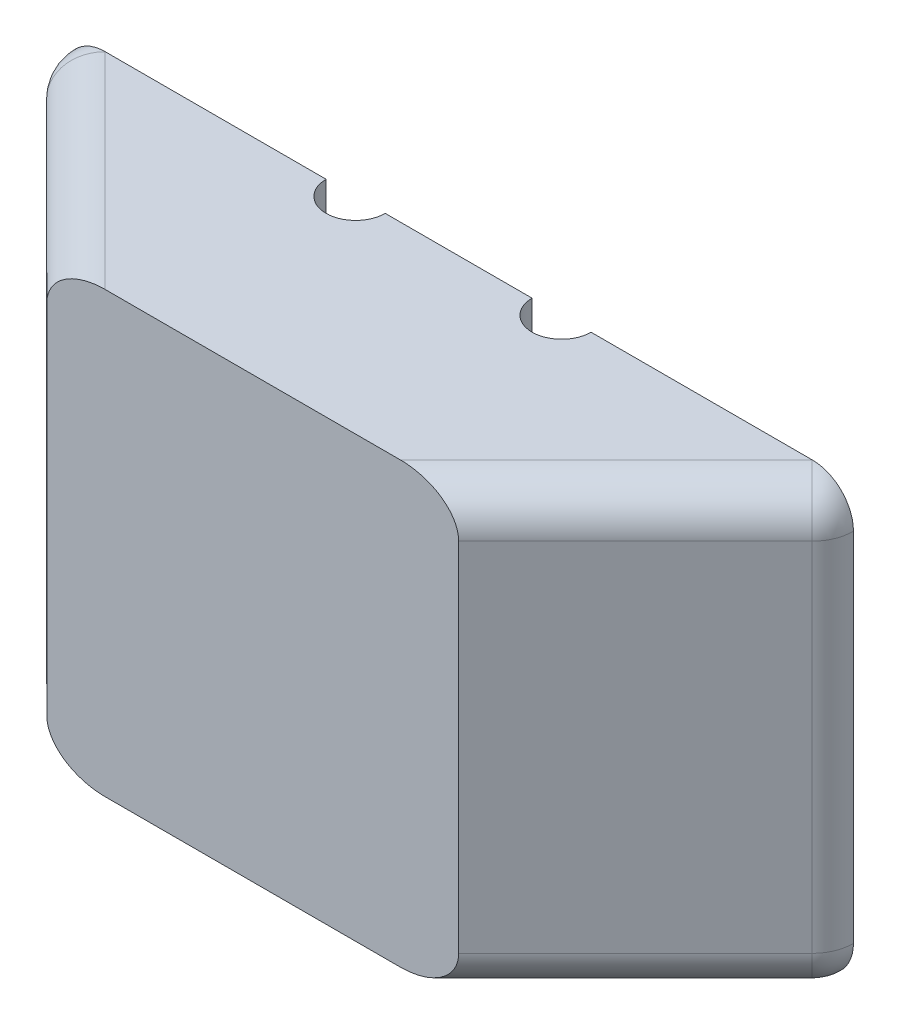
from build123d import *

# Parameters (mm, degrees)
SKETCH1_W           = 30
SKETCH1_H           = 30.000023288
BOSS_EXTRUDE2_DEPTH = 32
FILLET1_R           = 3
SKETCH3_R           = 2.15
CUT_EXTRUDE1_DEPTH  = 63
SKETCH5_W           = 78.057106385
SKETCH5_H           = 38.470116024
CUT_EXTRUDE2_DEPTH  = 63


with BuildPart() as part:
    # Sketch1 → Boss-Extrude2 (new body)
    with BuildSketch(Plane(origin=(0, 0, 0), x_dir=(1, 0, 0), z_dir=(0, 1, 0))):
        Polygon((-15, 15.000011644), (-15, -15.000011644), (-30, -0.01868994), align=None)
        Rectangle(SKETCH1_W, SKETCH1_H)
        Polygon((30, -0.01868994), (15, -15.000011644), (15, 15.000011644), align=None)
    extrude(amount=BOSS_EXTRUDE2_DEPTH)

    # Fillet1
    fillet1_edges = [part.edges().sort_by_distance(p)[0] for p in [
        (-22.5, 0, 7.509350792),
        (-30, 16, 0.01868994),
        (30, 16, 0.01868994),
        (22.5, 32, 7.509350792),
        (22.5, 32, -7.490660852),
        (-22.5, 32, -7.490660852),
        (-22.5, 32, 7.509350792),
        (-22.5, 0, -7.490660852),
        (22.5, 0, -7.490660852),
        (22.5, 0, 7.509350792),
    ]]
    fillet(fillet1_edges, radius=FILLET1_R)

    # Sketch3 → Cut-Extrude1 (cut)
    with BuildSketch(Plane(origin=(0, 32, 0), x_dir=(1, 0, 0), z_dir=(0, 1, 0))):
        with Locations(Location((-7.499998545, -0.004672484, 0), (0, 0, 270))):
            Circle(SKETCH3_R)
        with Locations(Location((7.5, 0.004672485, 0), (0, 0, 270))):
            Circle(SKETCH3_R)
    extrude(amount=-CUT_EXTRUDE1_DEPTH, mode=Mode.SUBTRACT)

    # Sketch5 → Cut-Extrude2 (cut)
    with BuildSketch(Plane.XY):
        with Locations((3.040380137, 18.388870108)):
            Rectangle(SKETCH5_W, SKETCH5_H)
    extrude(amount=-CUT_EXTRUDE2_DEPTH, mode=Mode.SUBTRACT)


solid = part.part
